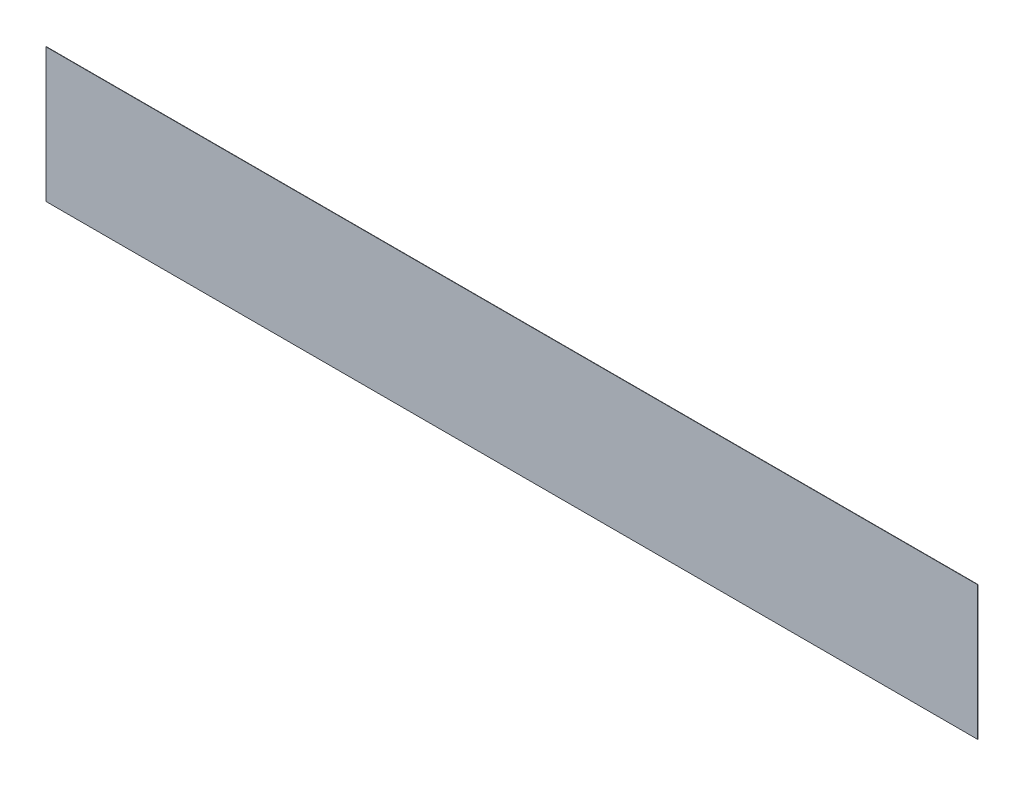
from build123d import *

# Parameters (mm, degrees)
SKETCH3_W           = 21.67
SKETCH3_H           = 19.56
SKETCH3_W_2         = 1.5
SKETCH3_W_3         = 4.5
BOSS_EXTRUDE1_DEPTH = 0.05


with BuildPart() as part:
    # Sketch3 → Boss-Extrude1 (new body)
    with BuildSketch(Plane.XY):
        with Locations((10.835, 0)):
            Rectangle(SKETCH3_W, SKETCH3_H)
        with Locations((32.505, 0)):
            Rectangle(SKETCH3_W, SKETCH3_H)
        with Locations((54.175, 0)):
            Rectangle(SKETCH3_W, SKETCH3_H)
        with Locations((75.845, 0)):
            Rectangle(SKETCH3_W, SKETCH3_H)
        with Locations((97.515, 0)):
            Rectangle(SKETCH3_W, SKETCH3_H)
        with Locations((119.185, 0)):
            Rectangle(SKETCH3_W, SKETCH3_H)
        with Locations((130.77, 0)):
            Rectangle(SKETCH3_W_2, SKETCH3_H)
        with Locations((-2.25, 0)):
            Rectangle(SKETCH3_W_3, SKETCH3_H)
    extrude(amount=BOSS_EXTRUDE1_DEPTH)


solid = part.part
